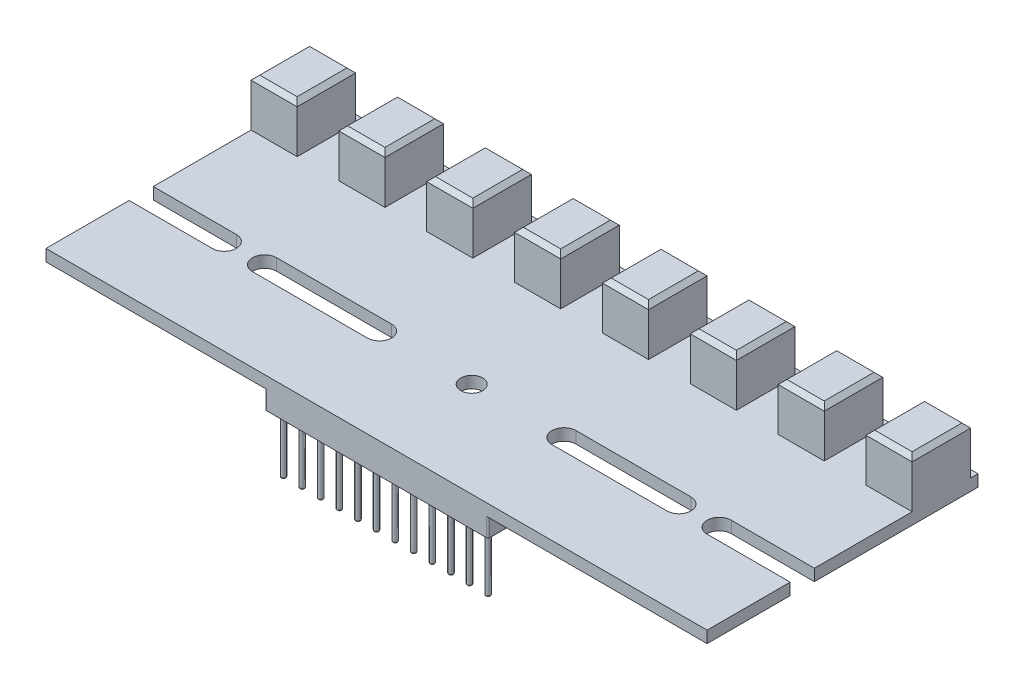
from build123d import *

# Parameters (mm, degrees)
SKETCH_1_R             = 1.5
EXTRUDE_1_DEPTH        = 0.8
SKETCH_2_W             = 6.3
SKETCH_2_H             = 8
EXTRUDE_2_DEPTH        = 6.5
CHAMFER_1_SIZE         = 0.6
SKETCH_3_W             = 15.24
SKETCH_3_H             = 2.54
SKETCH_3_R             = 0.32
EXTRUDE_3_DEPTH        = 2.54
SKETCH_3_3_R           = 0.32
EXTRUDE_4_DEPTH        = 10.54
FILLET_1_R             = 0.2
FILLET_1_OF_MIRROR_1_R = 0.2


with BuildPart() as part:
    # 草图1 → 凸台-拉伸1 (new, symmetric)
    with BuildSketch(Plane(origin=(0, 0, 0), x_dir=(1, 0, 0), z_dir=(0, 1, 0))):
        with BuildLine():
            Line((45.15, 24), (-45.15, 24))
            Line((-45.15, 24), (-45.15, 1.65))
            Line((-45.15, 1.65), (-33.8, 1.65))
            ThreePointArc((-33.8, 1.65), (-32.15, 0), (-33.8, -1.65))
            Line((-33.8, -1.65), (-45.15, -1.65))
            Line((-45.15, -1.65), (-45.15, -13))
            Line((-45.15, -13), (45.15, -13))
            Line((45.15, -13), (45.15, -1.65))
            Line((45.15, -1.65), (33.8, -1.65))
            ThreePointArc((33.8, -1.65), (32.15, 0), (33.8, 1.65))
            Line((33.8, 1.65), (45.15, 1.65))
            Line((45.15, 1.65), (45.15, 24))
        make_face()
        with BuildLine():
            ThreePointArc((-28.3, -1.65), (-29.95, 0), (-28.3, 1.65))
            Line((-28.3, 1.65), (-12.6, 1.65))
            ThreePointArc((-12.6, 1.65), (-10.95, 0), (-12.6, -1.65))
            Line((-12.6, -1.65), (-28.3, -1.65))
        make_face(mode=Mode.SUBTRACT)
        Circle(SKETCH_1_R, mode=Mode.SUBTRACT)
        with BuildLine():
            Line((12.6, 1.65), (28.3, 1.65))
            ThreePointArc((28.3, 1.65), (29.95, 0), (28.3, -1.65))
            Line((28.3, -1.65), (12.6, -1.65))
            ThreePointArc((12.6, -1.65), (10.95, 0), (12.6, 1.65))
        make_face(mode=Mode.SUBTRACT)
    extrude(amount=EXTRUDE_1_DEPTH, both=True)

    # 草图2 → 凸台-拉伸2 (add)
    with BuildSketch(Plane(origin=(0, 0.8, 0), x_dir=(1, 0, 0), z_dir=(0, 1, 0))):
        with Locations((-42, 19)):
            Rectangle(SKETCH_2_W, SKETCH_2_H)
        with Locations((-30, 19)):
            Rectangle(SKETCH_2_W, SKETCH_2_H)
        with Locations((-18, 19)):
            Rectangle(SKETCH_2_W, SKETCH_2_H)
        with Locations((-6, 19)):
            Rectangle(SKETCH_2_W, SKETCH_2_H)
        with Locations((6, 19)):
            Rectangle(SKETCH_2_W, SKETCH_2_H)
        with Locations((18, 19)):
            Rectangle(SKETCH_2_W, SKETCH_2_H)
        with Locations((30, 19)):
            Rectangle(SKETCH_2_W, SKETCH_2_H)
        with Locations((42, 19)):
            Rectangle(SKETCH_2_W, SKETCH_2_H)
    extrude(amount=EXTRUDE_2_DEPTH)

    # 倒角1
    chamfer_1_edges = [part.edges().sort_by_distance(p)[0] for p in [
        (42, 7.3, -23),
        (45.15, 7.3, -19),
        (42, 7.3, -15),
        (38.85, 7.3, -19),
        (30, 7.3, -23),
        (33.15, 7.3, -19),
        (30, 7.3, -15),
        (26.85, 7.3, -19),
        (18, 7.3, -23),
        (21.15, 7.3, -19),
        (18, 7.3, -15),
        (14.85, 7.3, -19),
        (6, 7.3, -23),
        (9.15, 7.3, -19),
        (6, 7.3, -15),
        (2.85, 7.3, -19),
        (-6, 7.3, -23),
        (-2.85, 7.3, -19),
        (-6, 7.3, -15),
        (-9.15, 7.3, -19),
        (-18, 7.3, -23),
        (-14.85, 7.3, -19),
        (-18, 7.3, -15),
        (-21.15, 7.3, -19),
        (-30, 7.3, -23),
        (-26.85, 7.3, -19),
        (-30, 7.3, -15),
        (-33.15, 7.3, -19),
        (-42, 7.3, -23),
        (-38.85, 7.3, -19),
        (-42, 7.3, -15),
        (-45.15, 7.3, -19),
    ]]
    chamfer(chamfer_1_edges, length=CHAMFER_1_SIZE)

    # 草图3 → 凸台-拉伸3 (add)
    with BuildSketch(Plane.XZ.offset(0.8)):
        with Locations((-7.62, 11.73)):
            Rectangle(SKETCH_3_W, SKETCH_3_H)
        with Locations((-3.81, 11.73)):
            Circle(SKETCH_3_R, mode=Mode.SUBTRACT)
        with Locations((-1.27, 11.73)):
            Circle(SKETCH_3_R, mode=Mode.SUBTRACT)
        with Locations((-6.35, 11.73)):
            Circle(SKETCH_3_R, mode=Mode.SUBTRACT)
        with Locations((-8.89, 11.73)):
            Circle(SKETCH_3_R, mode=Mode.SUBTRACT)
        with Locations((-11.43, 11.73)):
            Circle(SKETCH_3_R, mode=Mode.SUBTRACT)
        with Locations((-13.97, 11.73)):
            Circle(SKETCH_3_R, mode=Mode.SUBTRACT)
    extrude_3 = extrude(amount=EXTRUDE_3_DEPTH)

    # 草图3<3> → 凸台-拉伸4 (add)
    with BuildSketch(Plane.XZ.offset(0.8)):
        with Locations((-1.27, 11.73)):
            Circle(SKETCH_3_3_R)
        with Locations((-3.81, 11.73)):
            Circle(SKETCH_3_3_R)
        with Locations((-6.35, 11.73)):
            Circle(SKETCH_3_3_R)
        with Locations((-8.89, 11.73)):
            Circle(SKETCH_3_3_R)
        with Locations((-11.43, 11.73)):
            Circle(SKETCH_3_3_R)
        with Locations((-13.97, 11.73)):
            Circle(SKETCH_3_3_R)
    extrude_4 = extrude(amount=EXTRUDE_4_DEPTH)

    # 圆角1
    fillet_1_edges = [part.edges().sort_by_distance(p)[0] for p in [
        (-1.59, -11.34, 11.73),
        (-4.13, -11.34, 11.73),
        (-6.67, -11.34, 11.73),
        (-9.21, -11.34, 11.73),
        (-11.75, -11.34, 11.73),
        (-14.29, -11.34, 11.73),
        (-15.24, -2.07, 13),
        (-15.24, -2.07, 10.46),
    ]]
    fillet(fillet_1_edges, radius=FILLET_1_R)

    # 镜向1: 凸台-拉伸3, 凸台-拉伸4 across plane
    add(extrude_3.mirror(Plane(origin=(0, 0, 0), x_dir=(0, 0, 1), z_dir=(1, 0, 0))))
    add(extrude_4.mirror(Plane(origin=(0, 0, 0), x_dir=(0, 0, 1), z_dir=(1, 0, 0))))

    # 圆角1 of 镜向1
    fillet_1_of_mirror_1_edges = [part.edges().sort_by_distance(p)[0] for p in [
        (1.59, -11.34, 11.73),
        (4.13, -11.34, 11.73),
        (6.67, -11.34, 11.73),
        (9.21, -11.34, 11.73),
        (11.75, -11.34, 11.73),
        (14.29, -11.34, 11.73),
        (15.24, -2.07, 13),
        (15.24, -2.07, 10.46),
    ]]
    fillet(fillet_1_of_mirror_1_edges, radius=FILLET_1_OF_MIRROR_1_R)


solid = part.part
